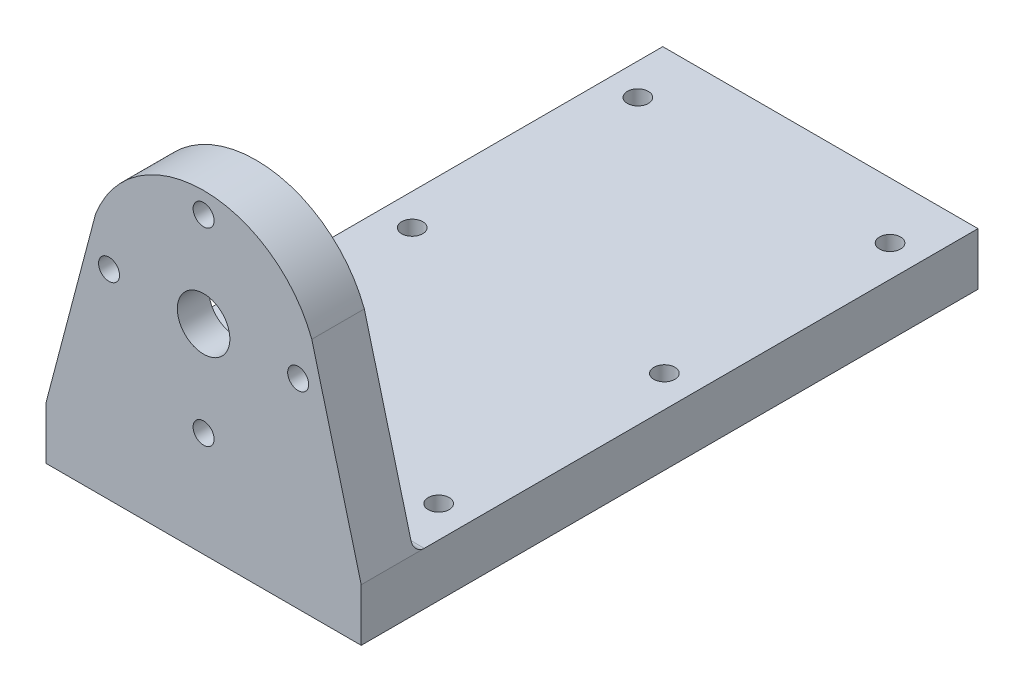
from build123d import *

# Parameters (mm, degrees)
BOSS_EXTRU_1_DEPTH      = 30
ESQUISSE2_R             = 2.5
ESQUISSE2_R_2           = 1
ENL_V_MAT_EXTRU_1_DEPTH = 73.427135799
ESQUISSE3_R             = 7
ENL_V_MAT_EXTRU_2_DEPTH = 2
ESQUISSE4_R             = 1
ENL_V_MAT_EXTRU_3_DEPTH = 71.503120498
CONG_2_R                = 1


with BuildPart() as part:
    # Esquisse1 → Boss.-Extru.1 (new body)
    with BuildSketch(Plane(origin=(0, 0, 0), x_dir=(0, 0, -1), z_dir=(1, 0, 0))):
        Polygon((0, 0), (0, 30), (5, 30), (5, 5), (58.7, 5), (58.7, 0), align=None)
    extrude(amount=BOSS_EXTRU_1_DEPTH)

    # Esquisse2 → Enlèv. mat.-Extru.1 (cut, through all)
    with BuildSketch(Plane.XY):
        with BuildLine():
            Line((0, 30), (0, 5))
            Line((0, 5), (4.705924288, 22.877113002))
            ThreePointArc((4.705924288, 22.877113002), (8.740936293, 28.04566866), (15, 30))
            Line((15, 30), (0, 30))
        make_face()
        with BuildLine():
            Line((30, 30), (15, 30))
            ThreePointArc((15, 30), (21.259063707, 28.04566866), (25.294075712, 22.877113002))
            Line((25.294075712, 22.877113002), (30, 5))
            Line((30, 5), (30, 30))
        make_face()
        with Locations((15, 19)):
            Circle(ESQUISSE2_R)
        with Locations((15, 28)):
            Circle(ESQUISSE2_R_2)
        with Locations((24, 19)):
            Circle(ESQUISSE2_R_2)
        with Locations((15, 10)):
            Circle(ESQUISSE2_R_2)
        with Locations((6, 19)):
            Circle(ESQUISSE2_R_2)
    extrude(amount=-ENL_V_MAT_EXTRU_1_DEPTH, mode=Mode.SUBTRACT)

    # Esquisse3 → Enlèv. mat.-Extru.2 (cut)
    with BuildSketch(Plane(origin=(0, 0, -5), x_dir=(-1, 0, 0), z_dir=(0, 0, -1))):
        with Locations((-15, 19)):
            Circle(ESQUISSE3_R)
    extrude(amount=-ENL_V_MAT_EXTRU_2_DEPTH, mode=Mode.SUBTRACT)

    # Esquisse4 → Enlèv. mat.-Extru.3 (cut, through all)
    with BuildSketch(Plane(origin=(0, 5, 0), x_dir=(1, 0, 0), z_dir=(0, 1, 0))):
        with Locations((3, 10.37)):
            Circle(ESQUISSE4_R)
        with Locations((27, 10.37)):
            Circle(ESQUISSE4_R)
        with Locations((27, 53.33)):
            Circle(ESQUISSE4_R)
        with Locations((3, 53.33)):
            Circle(ESQUISSE4_R)
        with Locations((3, 31.85)):
            Circle(ESQUISSE4_R)
        with Locations((27, 31.85)):
            Circle(ESQUISSE4_R)
    extrude(amount=-ENL_V_MAT_EXTRU_3_DEPTH, mode=Mode.SUBTRACT)

    # Congé2
    cong_2_edges = [part.edges().sort_by_distance(p)[0] for p in [
        (15, 5, -5),
    ]]
    fillet(cong_2_edges, radius=CONG_2_R)


solid = part.part
